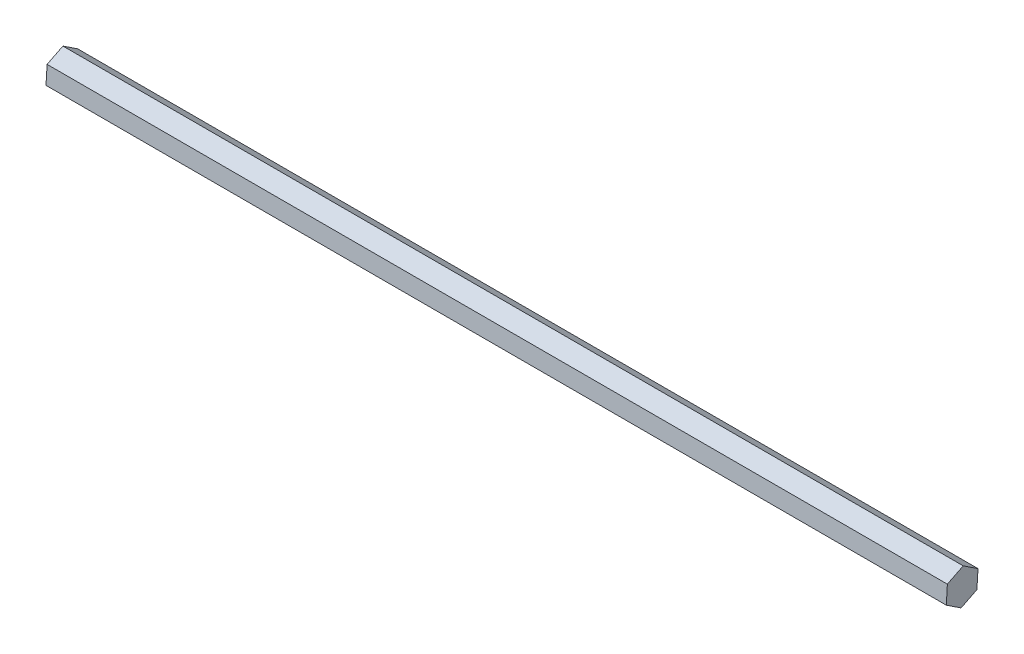
from build123d import *

# Parameters (mm, degrees)
BOSS_EXTRUDE2_DEPTH = 381


with BuildPart() as part:
    # Sketch1 → Boss-Extrude2 (new body)
    with BuildSketch(Plane(origin=(0, 0, 0), x_dir=(0, 0, -1), z_dir=(1, 0, 0))):
        Polygon((6.251352889, -4.137247622), (6.708637987, 3.345206599), (0.457285098, 7.482454221), (-6.251352889, 4.137247622), (-6.708637987, -3.345206599), (-0.457285098, -7.482454221), align=None)
    extrude(amount=BOSS_EXTRUDE2_DEPTH)


solid = part.part
